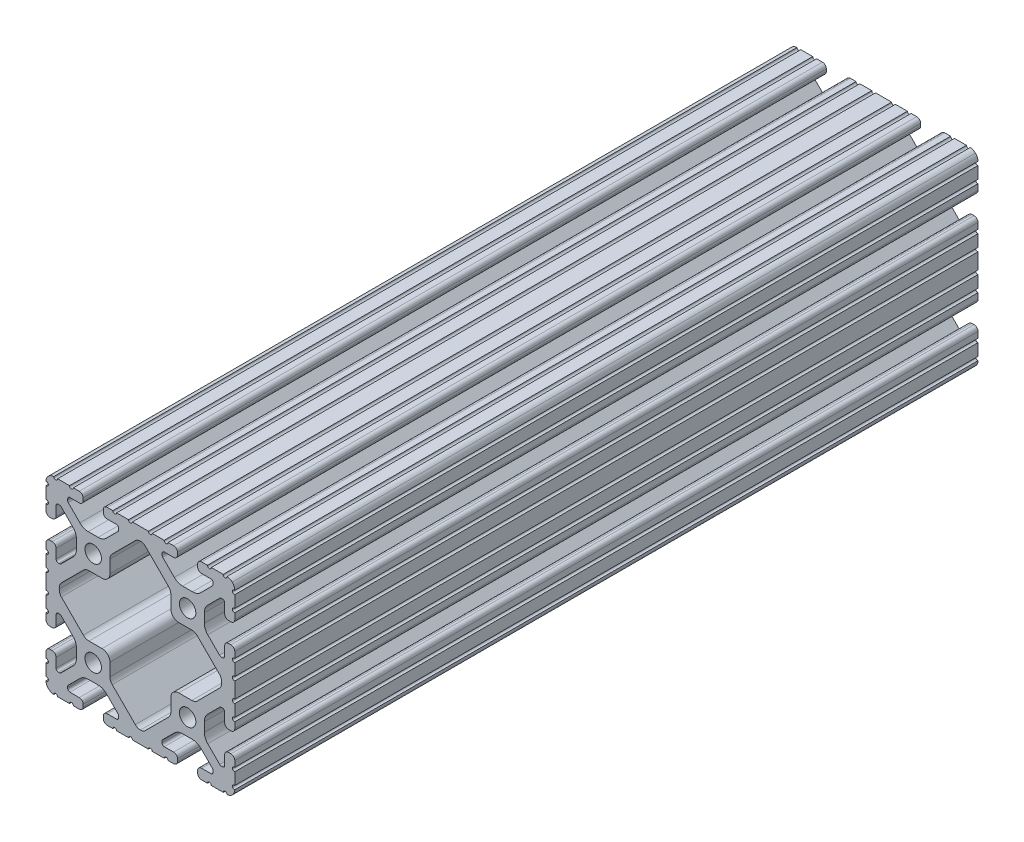
from build123d import *

# Parameters (mm, degrees)
BOSS_EXTRUDE1_DEPTH      = 150
BOSS_EXTRUDE1_DEPTH_BACK = 150
SKETCH3_R                = 3.3274


with BuildPart() as part:
    # Sketch3 → Boss-Extrude1 (new, two sides: drawn at the far end of the back side and taken through both)
    with BuildSketch(Plane.XY.offset(-BOSS_EXTRUDE1_DEPTH_BACK)):
        with BuildLine():
            Line((34.036, 28.448), (34.036, 24.630196049))
            ThreePointArc((34.036, 24.630196049), (34.497248241, 23.51664429), (35.6108, 23.055396049))
            Line((35.6108, 23.055396049), (36.525200183, 23.055396049))
            ThreePointArc((36.525200183, 23.055396049), (37.638751813, 23.516644236), (38.1, 24.630195866))
            Line((38.1, 24.630195866), (38.1, 27.023826138))
            ThreePointArc((38.1, 27.023826138), (37.117780706, 27.7845421), (38.1, 28.545258062))
            Line((38.1, 28.545258062), (38.1, 33.373016026))
            ThreePointArc((38.1, 33.373016026), (37.141472621, 34.109236774), (38.1, 34.845457521))
            ThreePointArc((38.1, 34.845457521), (37.837757813, 36.120195002), (37.086123144, 37.182631793))
            ThreePointArc((37.086123144, 37.182631793), (36.106286572, 37.843374398), (34.952681874, 38.1))
            ThreePointArc((34.952681874, 38.1), (34.190730434, 37.320215335), (33.428778994, 38.1))
            Line((33.428778994, 38.1), (28.601105935, 38.1))
            ThreePointArc((28.601105935, 38.1), (27.839158581, 37.32021942), (27.077211227, 38.1))
            Line((27.077211227, 38.1), (24.6888, 38.1))
            ThreePointArc((24.6888, 38.1), (23.575248241, 37.638751759), (23.114, 36.5252))
            Line((23.114, 36.5252), (23.114, 35.6108))
            ThreePointArc((23.114, 35.6108), (23.575248241, 34.497248241), (24.6888, 34.036))
            Line((24.6888, 34.036), (28.448, 34.036))
            ThreePointArc((28.448, 34.036), (29.076617928, 33.775617928), (29.337, 33.147))
            Line((29.337, 33.147), (29.337, 32.720693454))
            ThreePointArc((29.337, 32.720693454), (29.326675076, 32.273872751), (29.100231244, 31.888543625))
            Line((29.100231244, 31.888543625), (24.409287499, 27.197588341))
            ThreePointArc((24.409287499, 27.197588341), (22.868340045, 26.167958114), (21.050667579, 25.8064))
            Line((21.050667579, 25.8064), (17.049332421, 25.8064))
            ThreePointArc((17.049332421, 25.8064), (15.231659955, 26.167958114), (13.690712501, 27.197588341))
            Line((13.690712501, 27.197588341), (9.023381298, 31.864931024))
            ThreePointArc((9.023381298, 31.864931024), (8.830670886, 32.153343113), (8.763, 32.493548179))
            Line((8.763, 32.493548179), (8.763, 33.147))
            ThreePointArc((8.763, 33.147), (9.023382072, 33.775617928), (9.652, 34.036))
            Line((9.652, 34.036), (13.4112, 34.036))
            ThreePointArc((13.4112, 34.036), (14.524751759, 34.497248241), (14.986, 35.6108))
            Line((14.986, 35.6108), (14.986, 36.5252))
            ThreePointArc((14.986, 36.5252), (14.524751759, 37.638751759), (13.4112, 38.1))
            Line((13.4112, 38.1), (11.128867074, 38.1))
            ThreePointArc((11.128867074, 38.1), (10.367071033, 37.320370693), (9.605274992, 38.1))
            Line((9.605274992, 38.1), (4.777313069, 38.1))
            ThreePointArc((4.777313069, 38.1), (4.015517029, 37.320370693), (3.253720988, 38.1))
            Line((3.253720988, 38.1), (-3.253720988, 38.1))
            ThreePointArc((-3.253720988, 38.1), (-4.015517029, 37.320370693), (-4.777313069, 38.1))
            Line((-4.777313069, 38.1), (-9.605274992, 38.1))
            ThreePointArc((-9.605274992, 38.1), (-10.367071033, 37.320370693), (-11.128867074, 38.1))
            Line((-11.128867074, 38.1), (-13.4112, 38.1))
            ThreePointArc((-13.4112, 38.1), (-14.524751759, 37.638751759), (-14.986, 36.5252))
            Line((-14.986, 36.5252), (-14.986, 35.6108))
            ThreePointArc((-14.986, 35.6108), (-14.524751759, 34.497248241), (-13.4112, 34.036))
            Line((-13.4112, 34.036), (-9.652, 34.036))
            ThreePointArc((-9.652, 34.036), (-9.023382072, 33.775617928), (-8.763, 33.147))
            Line((-8.763, 33.147), (-8.763, 32.493548179))
            ThreePointArc((-8.763, 32.493548179), (-8.830670886, 32.153343113), (-9.023381298, 31.864931024))
            Line((-9.023381298, 31.864931024), (-13.690712501, 27.197588341))
            ThreePointArc((-13.690712501, 27.197588341), (-15.231659955, 26.167958114), (-17.049332421, 25.8064))
            Line((-17.049332421, 25.8064), (-21.050667579, 25.8064))
            ThreePointArc((-21.050667579, 25.8064), (-22.868340045, 26.167958114), (-24.409287499, 27.197588341))
            Line((-24.409287499, 27.197588341), (-29.100231244, 31.888543625))
            ThreePointArc((-29.100231244, 31.888543625), (-29.326675076, 32.273872751), (-29.337, 32.720693454))
            Line((-29.337, 32.720693454), (-29.337, 33.147))
            ThreePointArc((-29.337, 33.147), (-29.076617928, 33.775617928), (-28.448, 34.036))
            Line((-28.448, 34.036), (-24.6888, 34.036))
            ThreePointArc((-24.6888, 34.036), (-23.575248241, 34.497248241), (-23.114, 35.6108))
            Line((-23.114, 35.6108), (-23.114, 36.5252))
            ThreePointArc((-23.114, 36.5252), (-23.575248241, 37.638751759), (-24.6888, 38.1))
            Line((-24.6888, 38.1), (-27.077211227, 38.1))
            ThreePointArc((-27.077211227, 38.1), (-27.839158581, 37.32021942), (-28.601105935, 38.1))
            Line((-28.601105935, 38.1), (-33.428778994, 38.1))
            ThreePointArc((-33.428778994, 38.1), (-34.190730434, 37.320215335), (-34.952681874, 38.1))
            ThreePointArc((-34.952681874, 38.1), (-36.106286572, 37.843374398), (-37.086123144, 37.182631793))
            ThreePointArc((-37.086123144, 37.182631793), (-37.837757813, 36.120195002), (-38.1, 34.845457521))
            ThreePointArc((-38.1, 34.845457521), (-37.141472621, 34.109236774), (-38.1, 33.373016026))
            Line((-38.1, 33.373016026), (-38.1, 28.545258062))
            ThreePointArc((-38.1, 28.545258062), (-37.117780706, 27.7845421), (-38.1, 27.023826138))
            Line((-38.1, 27.023826138), (-38.1, 24.630195866))
            ThreePointArc((-38.1, 24.630195866), (-37.638751813, 23.516644236), (-36.525200183, 23.055396049))
            Line((-36.525200183, 23.055396049), (-35.6108, 23.055396049))
            ThreePointArc((-35.6108, 23.055396049), (-34.497248241, 23.51664429), (-34.036, 24.630196049))
            Line((-34.036, 24.630196049), (-34.036, 28.448))
            ThreePointArc((-34.036, 28.448), (-33.775617928, 29.076617928), (-33.147, 29.337))
            Line((-33.147, 29.337), (-32.664287242, 29.337))
            ThreePointArc((-32.664287242, 29.337), (-32.324081166, 29.269328695), (-32.03566854, 29.076617155))
            Line((-32.03566854, 29.076617155), (-27.19758008, 24.238516795))
            ThreePointArc((-27.19758008, 24.238516795), (-26.167955879, 22.697572205), (-25.8064, 20.879905136))
            Line((-25.8064, 20.879905136), (-25.8064, 17.220094864))
            ThreePointArc((-25.8064, 17.220094864), (-26.167955879, 15.402427795), (-27.19758008, 13.861483205))
            Line((-27.19758008, 13.861483205), (-31.948944541, 9.110107057))
            ThreePointArc((-31.948944541, 9.110107057), (-32.333417096, 8.853210196), (-32.786933649, 8.763))
            Line((-32.786933649, 8.763), (-33.060275787, 8.763))
            ThreePointArc((-33.060275787, 8.763), (-33.750216995, 9.048783005), (-34.036, 9.738724213))
            Line((-34.036, 9.738724213), (-34.036, 13.469803585))
            ThreePointArc((-34.036, 13.469803585), (-34.497248348, 14.583355603), (-35.610800366, 15.044603951))
            Line((-35.610800366, 15.044603951), (-36.5252, 15.044603951))
            ThreePointArc((-36.5252, 15.044603951), (-37.638751759, 14.58335571), (-38.1, 13.469803951))
            Line((-38.1, 13.469803951), (-38.1, 11.075039289))
            ThreePointArc((-38.1, 11.075039289), (-37.117000248, 10.313517272), (-38.1, 9.551995255))
            Line((-38.1, 9.551995255), (-38.1, 4.723759308))
            ThreePointArc((-38.1, 4.723759308), (-37.117000248, 3.962237292), (-38.1, 3.200715275))
            Line((-38.1, 3.200715275), (-38.1, -3.200715275))
            ThreePointArc((-38.1, -3.200715275), (-37.117000248, -3.962237292), (-38.1, -4.723759308))
            Line((-38.1, -4.723759308), (-38.1, -9.551995255))
            ThreePointArc((-38.1, -9.551995255), (-37.117000248, -10.313517272), (-38.1, -11.075039289))
            Line((-38.1, -11.075039289), (-38.1, -13.469803951))
            ThreePointArc((-38.1, -13.469803951), (-37.638751759, -14.58335571), (-36.5252, -15.044603951))
            Line((-36.5252, -15.044603951), (-35.610800366, -15.044603951))
            ThreePointArc((-35.610800366, -15.044603951), (-34.497248348, -14.583355603), (-34.036, -13.469803585))
            Line((-34.036, -13.469803585), (-34.036, -9.738724213))
            ThreePointArc((-34.036, -9.738724213), (-33.750216995, -9.048783005), (-33.060275787, -8.763))
            Line((-33.060275787, -8.763), (-32.786933649, -8.763))
            ThreePointArc((-32.786933649, -8.763), (-32.333417096, -8.853210196), (-31.948944541, -9.110107057))
            Line((-31.948944541, -9.110107057), (-27.19758008, -13.861483205))
            ThreePointArc((-27.19758008, -13.861483205), (-26.167955879, -15.402427795), (-25.8064, -17.220094864))
            Line((-25.8064, -17.220094864), (-25.8064, -20.879905136))
            ThreePointArc((-25.8064, -20.879905136), (-26.167955879, -22.697572205), (-27.19758008, -24.238516795))
            Line((-27.19758008, -24.238516795), (-32.03566854, -29.076617155))
            ThreePointArc((-32.03566854, -29.076617155), (-32.324081166, -29.269328695), (-32.664287242, -29.337))
            Line((-32.664287242, -29.337), (-33.147, -29.337))
            ThreePointArc((-33.147, -29.337), (-33.775617928, -29.076617928), (-34.036, -28.448))
            Line((-34.036, -28.448), (-34.036, -24.630196049))
            ThreePointArc((-34.036, -24.630196049), (-34.497248241, -23.51664429), (-35.6108, -23.055396049))
            Line((-35.6108, -23.055396049), (-36.525200183, -23.055396049))
            ThreePointArc((-36.525200183, -23.055396049), (-37.638751813, -23.516644236), (-38.1, -24.630195866))
            Line((-38.1, -24.630195866), (-38.1, -27.023826138))
            ThreePointArc((-38.1, -27.023826138), (-37.117780706, -27.7845421), (-38.1, -28.545258062))
            Line((-38.1, -28.545258062), (-38.1, -33.373016026))
            ThreePointArc((-38.1, -33.373016026), (-37.141472621, -34.109236774), (-38.1, -34.845457521))
            ThreePointArc((-38.1, -34.845457521), (-37.837757813, -36.120195002), (-37.086123144, -37.182631793))
            ThreePointArc((-37.086123144, -37.182631793), (-36.106286572, -37.843374398), (-34.952681874, -38.1))
            ThreePointArc((-34.952681874, -38.1), (-34.190730434, -37.320215335), (-33.428778994, -38.1))
            Line((-33.428778994, -38.1), (-28.601105935, -38.1))
            ThreePointArc((-28.601105935, -38.1), (-27.839158581, -37.32021942), (-27.077211227, -38.1))
            Line((-27.077211227, -38.1), (-24.6888, -38.1))
            ThreePointArc((-24.6888, -38.1), (-23.575248241, -37.638751759), (-23.114, -36.5252))
            Line((-23.114, -36.5252), (-23.114, -35.6108))
            ThreePointArc((-23.114, -35.6108), (-23.575248241, -34.497248241), (-24.6888, -34.036))
            Line((-24.6888, -34.036), (-28.448, -34.036))
            ThreePointArc((-28.448, -34.036), (-29.076617928, -33.775617928), (-29.337, -33.147))
            Line((-29.337, -33.147), (-29.337, -32.720693454))
            ThreePointArc((-29.337, -32.720693454), (-29.326675076, -32.273872751), (-29.100231244, -31.888543625))
            Line((-29.100231244, -31.888543625), (-24.409287499, -27.197588341))
            ThreePointArc((-24.409287499, -27.197588341), (-22.868340045, -26.167958114), (-21.050667579, -25.8064))
            Line((-21.050667579, -25.8064), (-17.049332421, -25.8064))
            ThreePointArc((-17.049332421, -25.8064), (-15.231659955, -26.167958114), (-13.690712501, -27.197588341))
            Line((-13.690712501, -27.197588341), (-9.023381298, -31.864931024))
            ThreePointArc((-9.023381298, -31.864931024), (-8.830670886, -32.153343113), (-8.763, -32.493548179))
            Line((-8.763, -32.493548179), (-8.763, -33.147))
            ThreePointArc((-8.763, -33.147), (-9.023382072, -33.775617928), (-9.652, -34.036))
            Line((-9.652, -34.036), (-13.4112, -34.036))
            ThreePointArc((-13.4112, -34.036), (-14.524751759, -34.497248241), (-14.986, -35.6108))
            Line((-14.986, -35.6108), (-14.986, -36.5252))
            ThreePointArc((-14.986, -36.5252), (-14.524751759, -37.638751759), (-13.4112, -38.1))
            Line((-13.4112, -38.1), (-11.128867074, -38.1))
            ThreePointArc((-11.128867074, -38.1), (-10.367071033, -37.320370693), (-9.605274992, -38.1))
            Line((-9.605274992, -38.1), (-4.777313069, -38.1))
            ThreePointArc((-4.777313069, -38.1), (-4.015517029, -37.320370693), (-3.253720988, -38.1))
            Line((-3.253720988, -38.1), (3.253720988, -38.1))
            ThreePointArc((3.253720988, -38.1), (4.015517029, -37.320370693), (4.777313069, -38.1))
            Line((4.777313069, -38.1), (9.605274992, -38.1))
            ThreePointArc((9.605274992, -38.1), (10.367071033, -37.320370693), (11.128867074, -38.1))
            Line((11.128867074, -38.1), (13.4112, -38.1))
            ThreePointArc((13.4112, -38.1), (14.524751759, -37.638751759), (14.986, -36.5252))
            Line((14.986, -36.5252), (14.986, -35.6108))
            ThreePointArc((14.986, -35.6108), (14.524751759, -34.497248241), (13.4112, -34.036))
            Line((13.4112, -34.036), (9.652, -34.036))
            ThreePointArc((9.652, -34.036), (9.023382072, -33.775617928), (8.763, -33.147))
            Line((8.763, -33.147), (8.763, -32.493548179))
            ThreePointArc((8.763, -32.493548179), (8.830670886, -32.153343113), (9.023381298, -31.864931024))
            Line((9.023381298, -31.864931024), (13.690712501, -27.197588341))
            ThreePointArc((13.690712501, -27.197588341), (15.231659955, -26.167958114), (17.049332421, -25.8064))
            Line((17.049332421, -25.8064), (21.050667579, -25.8064))
            ThreePointArc((21.050667579, -25.8064), (22.868340045, -26.167958114), (24.409287499, -27.197588341))
            Line((24.409287499, -27.197588341), (29.100231244, -31.888543625))
            ThreePointArc((29.100231244, -31.888543625), (29.326675076, -32.273872751), (29.337, -32.720693454))
            Line((29.337, -32.720693454), (29.337, -33.147))
            ThreePointArc((29.337, -33.147), (29.076617928, -33.775617928), (28.448, -34.036))
            Line((28.448, -34.036), (24.6888, -34.036))
            ThreePointArc((24.6888, -34.036), (23.575248241, -34.497248241), (23.114, -35.6108))
            Line((23.114, -35.6108), (23.114, -36.5252))
            ThreePointArc((23.114, -36.5252), (23.575248241, -37.638751759), (24.6888, -38.1))
            Line((24.6888, -38.1), (27.077211227, -38.1))
            ThreePointArc((27.077211227, -38.1), (27.839158581, -37.32021942), (28.601105935, -38.1))
            Line((28.601105935, -38.1), (33.428778994, -38.1))
            ThreePointArc((33.428778994, -38.1), (34.190730434, -37.320215335), (34.952681874, -38.1))
            ThreePointArc((34.952681874, -38.1), (36.106286572, -37.843374398), (37.086123144, -37.182631793))
            ThreePointArc((37.086123144, -37.182631793), (37.837757813, -36.120195002), (38.1, -34.845457521))
            ThreePointArc((38.1, -34.845457521), (37.141472621, -34.109236774), (38.1, -33.373016026))
            Line((38.1, -33.373016026), (38.1, -28.545258062))
            ThreePointArc((38.1, -28.545258062), (37.117780706, -27.7845421), (38.1, -27.023826138))
            Line((38.1, -27.023826138), (38.1, -24.630195866))
            ThreePointArc((38.1, -24.630195866), (37.638751813, -23.516644236), (36.525200183, -23.055396049))
            Line((36.525200183, -23.055396049), (35.6108, -23.055396049))
            ThreePointArc((35.6108, -23.055396049), (34.497248241, -23.51664429), (34.036, -24.630196049))
            Line((34.036, -24.630196049), (34.036, -28.448))
            ThreePointArc((34.036, -28.448), (33.775617928, -29.076617928), (33.147, -29.337))
            Line((33.147, -29.337), (32.664287242, -29.337))
            ThreePointArc((32.664287242, -29.337), (32.324081166, -29.269328695), (32.03566854, -29.076617155))
            Line((32.03566854, -29.076617155), (27.19758008, -24.238516795))
            ThreePointArc((27.19758008, -24.238516795), (26.167955879, -22.697572205), (25.8064, -20.879905136))
            Line((25.8064, -20.879905136), (25.8064, -17.220094864))
            ThreePointArc((25.8064, -17.220094864), (26.167955879, -15.402427795), (27.19758008, -13.861483205))
            Line((27.19758008, -13.861483205), (31.948944541, -9.110107057))
            ThreePointArc((31.948944541, -9.110107057), (32.333417096, -8.853210196), (32.786933649, -8.763))
            Line((32.786933649, -8.763), (33.060275787, -8.763))
            ThreePointArc((33.060275787, -8.763), (33.750216995, -9.048783005), (34.036, -9.738724213))
            Line((34.036, -9.738724213), (34.036, -13.469803585))
            ThreePointArc((34.036, -13.469803585), (34.497248348, -14.583355603), (35.610800366, -15.044603951))
            Line((35.610800366, -15.044603951), (36.5252, -15.044603951))
            ThreePointArc((36.5252, -15.044603951), (37.638751759, -14.58335571), (38.1, -13.469803951))
            Line((38.1, -13.469803951), (38.1, -11.075039289))
            ThreePointArc((38.1, -11.075039289), (37.117000248, -10.313517272), (38.1, -9.551995255))
            Line((38.1, -9.551995255), (38.1, -4.723759308))
            ThreePointArc((38.1, -4.723759308), (37.117000248, -3.962237292), (38.1, -3.200715275))
            Line((38.1, -3.200715275), (38.1, 3.200715275))
            ThreePointArc((38.1, 3.200715275), (37.117000248, 3.962237292), (38.1, 4.723759308))
            Line((38.1, 4.723759308), (38.1, 9.551995255))
            ThreePointArc((38.1, 9.551995255), (37.117000248, 10.313517272), (38.1, 11.075039289))
            Line((38.1, 11.075039289), (38.1, 13.469803951))
            ThreePointArc((38.1, 13.469803951), (37.638751759, 14.58335571), (36.5252, 15.044603951))
            Line((36.5252, 15.044603951), (35.610800366, 15.044603951))
            ThreePointArc((35.610800366, 15.044603951), (34.497248348, 14.583355603), (34.036, 13.469803585))
            Line((34.036, 13.469803585), (34.036, 9.738724213))
            ThreePointArc((34.036, 9.738724213), (33.750216995, 9.048783005), (33.060275787, 8.763))
            Line((33.060275787, 8.763), (32.786933649, 8.763))
            ThreePointArc((32.786933649, 8.763), (32.333417096, 8.853210196), (31.948944541, 9.110107057))
            Line((31.948944541, 9.110107057), (27.19758008, 13.861483205))
            ThreePointArc((27.19758008, 13.861483205), (26.167955879, 15.402427795), (25.8064, 17.220094864))
            Line((25.8064, 17.220094864), (25.8064, 20.879905136))
            ThreePointArc((25.8064, 20.879905136), (26.167955879, 22.697572205), (27.19758008, 24.238516795))
            Line((27.19758008, 24.238516795), (32.03566854, 29.076617155))
            ThreePointArc((32.03566854, 29.076617155), (32.324081166, 29.269328695), (32.664287242, 29.337))
            Line((32.664287242, 29.337), (33.147, 29.337))
            ThreePointArc((33.147, 29.337), (33.775617928, 29.076617928), (34.036, 28.448))
        make_face()
        with Locations((19.05, 19.05)):
            Circle(SKETCH3_R, mode=Mode.SUBTRACT)
        with Locations((-19.05, 19.05)):
            Circle(SKETCH3_R, mode=Mode.SUBTRACT)
        with Locations((19.05, -19.05)):
            Circle(SKETCH3_R, mode=Mode.SUBTRACT)
        with Locations((-19.05, -19.05)):
            Circle(SKETCH3_R, mode=Mode.SUBTRACT)
        with BuildLine():
            Line((-11.363666791, -22.843321003), (-2.051515952, -32.155494748))
            ThreePointArc((-2.051515952, -32.155494748), (-1.11031328, -32.786013752), (0, -33.011005091))
            ThreePointArc((0, -33.011005091), (1.11031328, -32.786013752), (2.051515952, -32.155494748))
            Line((2.051515952, -32.155494748), (11.363666791, -22.843321003))
            ThreePointArc((11.363666791, -22.843321003), (12.051918263, -21.813277828), (12.2936, -20.598259734))
            Line((12.2936, -20.598259734), (12.2936, -15.4686))
            ThreePointArc((12.2936, -15.4686), (13.22353597, -13.22353597), (15.4686, -12.2936))
            Line((15.4686, -12.2936), (20.769026744, -12.2936))
            ThreePointArc((20.769026744, -12.2936), (21.984048446, -12.051916769), (23.014093535, -11.363661269))
            Line((23.014093535, -11.363661269), (31.902125566, -2.475607377))
            ThreePointArc((31.902125566, -2.475607377), (32.607298578, -1.335259481), (32.728725173, 0))
            ThreePointArc((32.728725173, 0), (32.607298578, 1.335259481), (31.902125566, 2.475607377))
            Line((31.902125566, 2.475607377), (23.014093535, 11.363661269))
            ThreePointArc((23.014093535, 11.363661269), (21.984048446, 12.051916769), (20.769026744, 12.2936))
            Line((20.769026744, 12.2936), (15.4686, 12.2936))
            ThreePointArc((15.4686, 12.2936), (13.22353597, 13.22353597), (12.2936, 15.4686))
            Line((12.2936, 15.4686), (12.2936, 20.598259734))
            ThreePointArc((12.2936, 20.598259734), (12.051918263, 21.813277828), (11.363666791, 22.843321003))
            Line((11.363666791, 22.843321003), (2.051515952, 32.155494748))
            ThreePointArc((2.051515952, 32.155494748), (1.11031328, 32.786013752), (0, 33.011005091))
            ThreePointArc((0, 33.011005091), (-1.11031328, 32.786013752), (-2.051515952, 32.155494748))
            Line((-2.051515952, 32.155494748), (-11.363666791, 22.843321003))
            ThreePointArc((-11.363666791, 22.843321003), (-12.051918263, 21.813277828), (-12.2936, 20.598259734))
            Line((-12.2936, 20.598259734), (-12.2936, 15.4686))
            ThreePointArc((-12.2936, 15.4686), (-13.22353597, 13.22353597), (-15.4686, 12.2936))
            Line((-15.4686, 12.2936), (-20.769026744, 12.2936))
            ThreePointArc((-20.769026744, 12.2936), (-21.984048446, 12.051916769), (-23.014093535, 11.363661269))
            Line((-23.014093535, 11.363661269), (-31.902125566, 2.475607377))
            ThreePointArc((-31.902125566, 2.475607377), (-32.607298578, 1.335259481), (-32.728725173, 0))
            ThreePointArc((-32.728725173, 0), (-32.607298578, -1.335259481), (-31.902125566, -2.475607377))
            Line((-31.902125566, -2.475607377), (-23.014093535, -11.363661269))
            ThreePointArc((-23.014093535, -11.363661269), (-21.984048446, -12.051916769), (-20.769026744, -12.2936))
            Line((-20.769026744, -12.2936), (-15.4686, -12.2936))
            ThreePointArc((-15.4686, -12.2936), (-13.22353597, -13.22353597), (-12.2936, -15.4686))
            Line((-12.2936, -15.4686), (-12.2936, -20.598259734))
            ThreePointArc((-12.2936, -20.598259734), (-12.051918263, -21.813277828), (-11.363666791, -22.843321003))
        make_face(mode=Mode.SUBTRACT)
    extrude(amount=BOSS_EXTRUDE1_DEPTH + BOSS_EXTRUDE1_DEPTH_BACK)


solid = part.part
